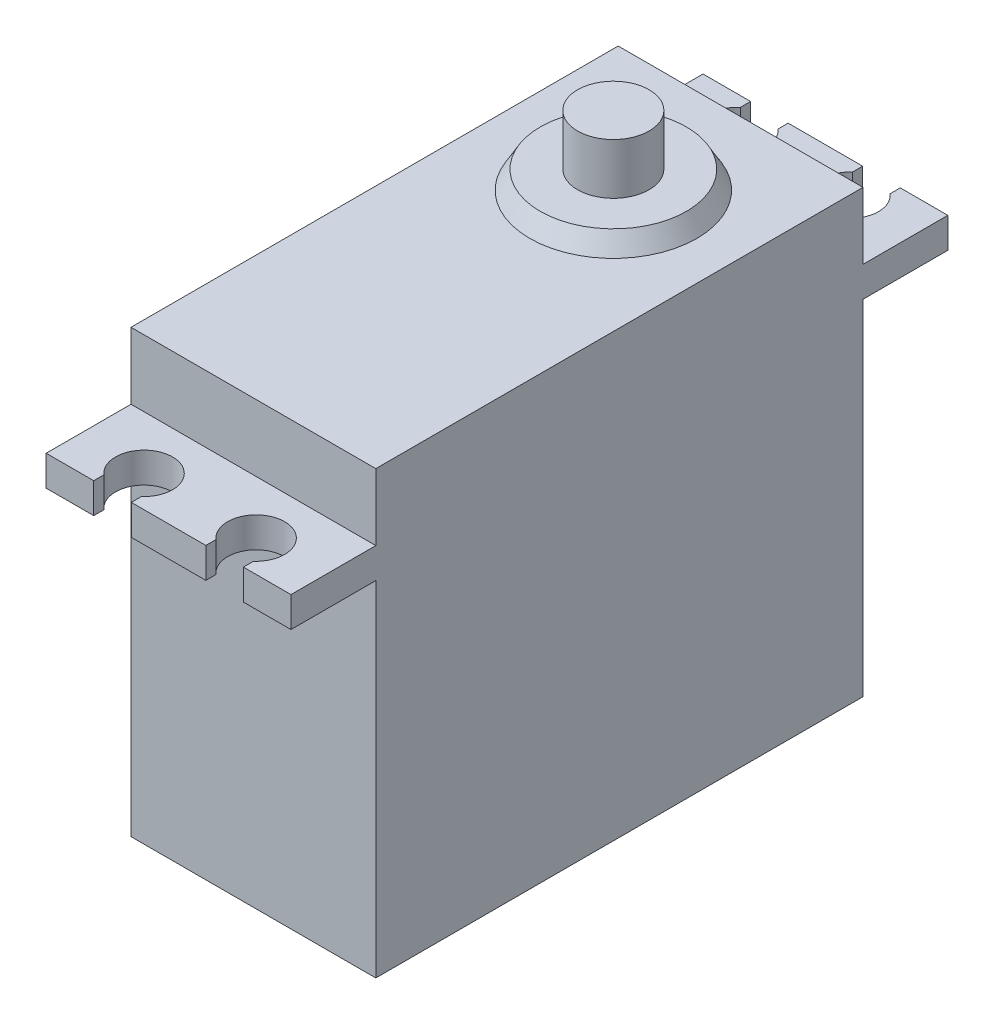
from build123d import *

# Parameters (mm, degrees)
BOSS_EXTRU_1_DEPTH      = 20.2
ESQUISSE2_R             = 2.35
ENL_V_MAT_EXTRU_1_DEPTH = 60.922366442
ESQUISSE8_W             = 3.1
ESQUISSE8_H             = 3.49339615
ENL_V_MAT_EXTRU_2_DEPTH = 10
ESQUISSE3_R             = 2.95
BOSS_EXTRU_2_DEPTH      = 5.7
ESQUISSE5_R             = 6.9
BOSS_EXTRU_4_DEPTH      = 1.5
BOSS_EXTRU_4_TAPER      = 30
ESQUISSE6_W             = 7
ESQUISSE6_H             = 4
BOSS_EXTRU_5_DEPTH      = 1
BOSS_EXTRU_6_DEPTH      = 4


with BuildPart() as part:
    # Esquisse1 → Boss.-Extru.1 (new body)
    with BuildSketch(Plane(origin=(0, 0, 0), x_dir=(0, 0, -1), z_dir=(1, 0, 0))):
        Polygon((0, 0), (40.2, 0), (40.2, 28.4), (47.2, 28.4), (47.2, 30.9), (40.2, 30.9), (40.2, 36.4), (0, 36.4), (0, 30.9), (-7, 30.9), (-7, 28.4), (0, 28.4), align=None)
    extrude(amount=BOSS_EXTRU_1_DEPTH)

    # Esquisse2 → Enlèv. mat.-Extru.1 (cut, through all)
    with BuildSketch(Plane(origin=(0, 30.9, 0), x_dir=(1, 0, 0), z_dir=(0, 1, 0))):
        with Locations(Location((5.475, 44.6, 0), (0, 0, 270))):
            Circle(ESQUISSE2_R)
        with Locations(Location((14.725, 44.6, 0), (0, 0, 270))):
            Circle(ESQUISSE2_R)
        with Locations(Location((14.725, -4.4, 0), (0, 0, 270))):
            Circle(ESQUISSE2_R)
        with Locations(Location((5.475, -4.4, 0), (0, 0, 270))):
            Circle(ESQUISSE2_R)
    extrude(amount=-ENL_V_MAT_EXTRU_1_DEPTH, mode=Mode.SUBTRACT)

    # Esquisse8 → Enlèv. mat.-Extru.2 (cut)
    with BuildSketch(Plane(origin=(0, 30.9, 0), x_dir=(1, 0, 0), z_dir=(0, 1, 0))):
        with Locations((5.475, 46.933629306)):
            Rectangle(ESQUISSE8_W, ESQUISSE8_H)
        with Locations((14.725, 46.933629306)):
            Rectangle(ESQUISSE8_W, ESQUISSE8_H)
        with Locations((14.725, -6.733629306)):
            Rectangle(ESQUISSE8_W, ESQUISSE8_H)
        with Locations((5.475, -6.733629306)):
            Rectangle(ESQUISSE8_W, ESQUISSE8_H)
    extrude(amount=-ENL_V_MAT_EXTRU_2_DEPTH, mode=Mode.SUBTRACT)

    # Esquisse3 → Boss.-Extru.2 (add)
    with BuildSketch(Plane(origin=(0, 36.4, 0), x_dir=(1, 0, 0), z_dir=(0, 1, 0))):
        with Locations(Location((10.1, 29.7, 0), (0, 0, 90))):
            Circle(ESQUISSE3_R)
    extrude(amount=BOSS_EXTRU_2_DEPTH)

    # Esquisse5 → Boss.-Extru.4 (add)
    with BuildSketch(Plane(origin=(0, 36.4, 0), x_dir=(1, 0, 0), z_dir=(0, 1, 0))):
        with Locations((10.1, 29.7)):
            Circle(ESQUISSE5_R)
    extrude(amount=BOSS_EXTRU_4_DEPTH, taper=BOSS_EXTRU_4_TAPER)

    # Esquisse6 → Boss.-Extru.5 (add)
    with BuildSketch(Plane(origin=(0, 0, -40.2), x_dir=(-1, 0, 0), z_dir=(0, 0, -1))):
        with Locations((-10.1, 5)):
            Rectangle(ESQUISSE6_W, ESQUISSE6_H)
    extrude(amount=BOSS_EXTRU_5_DEPTH)

    # Esquisse7 → Boss.-Extru.6 (add)
    with BuildSketch(Plane(origin=(0, 0, -41.2), x_dir=(-1, 0, 0), z_dir=(0, 0, -1))):
        with BuildLine():
            Line((-11.4, 6.55), (-8.8, 6.55))
            ThreePointArc((-8.8, 6.55), (-7.25, 5), (-8.8, 3.45))
            Line((-8.8, 3.45), (-11.4, 3.45))
            ThreePointArc((-11.4, 3.45), (-12.95, 5), (-11.4, 6.55))
        make_face()
    extrude(amount=BOSS_EXTRU_6_DEPTH)


solid = part.part
